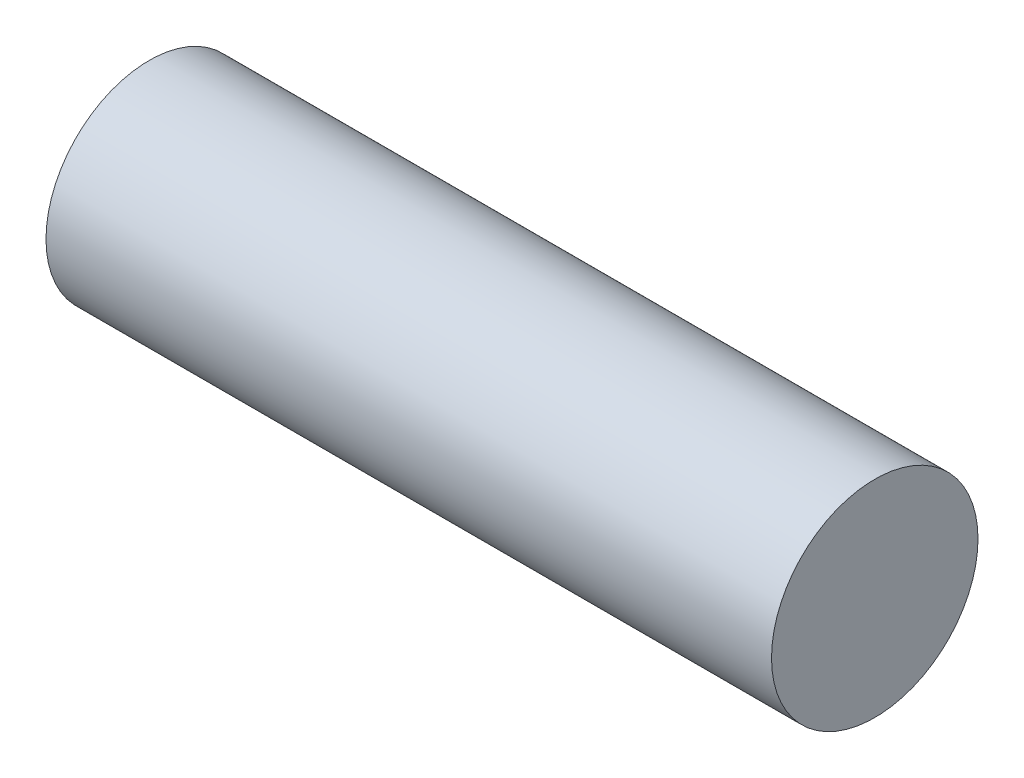
from build123d import *

# Parameters (mm, degrees)
SKETCH1_R           = 9.25
BOSS_EXTRUDE1_DEPTH = 32.5


with BuildPart() as part:
    # Sketch1 → Boss-Extrude1 (new, symmetric)
    with BuildSketch(Plane(origin=(0, 0, 0), x_dir=(0, 0, -1), z_dir=(1, 0, 0))):
        Circle(SKETCH1_R)
    extrude(amount=BOSS_EXTRUDE1_DEPTH, both=True)


solid = part.part
